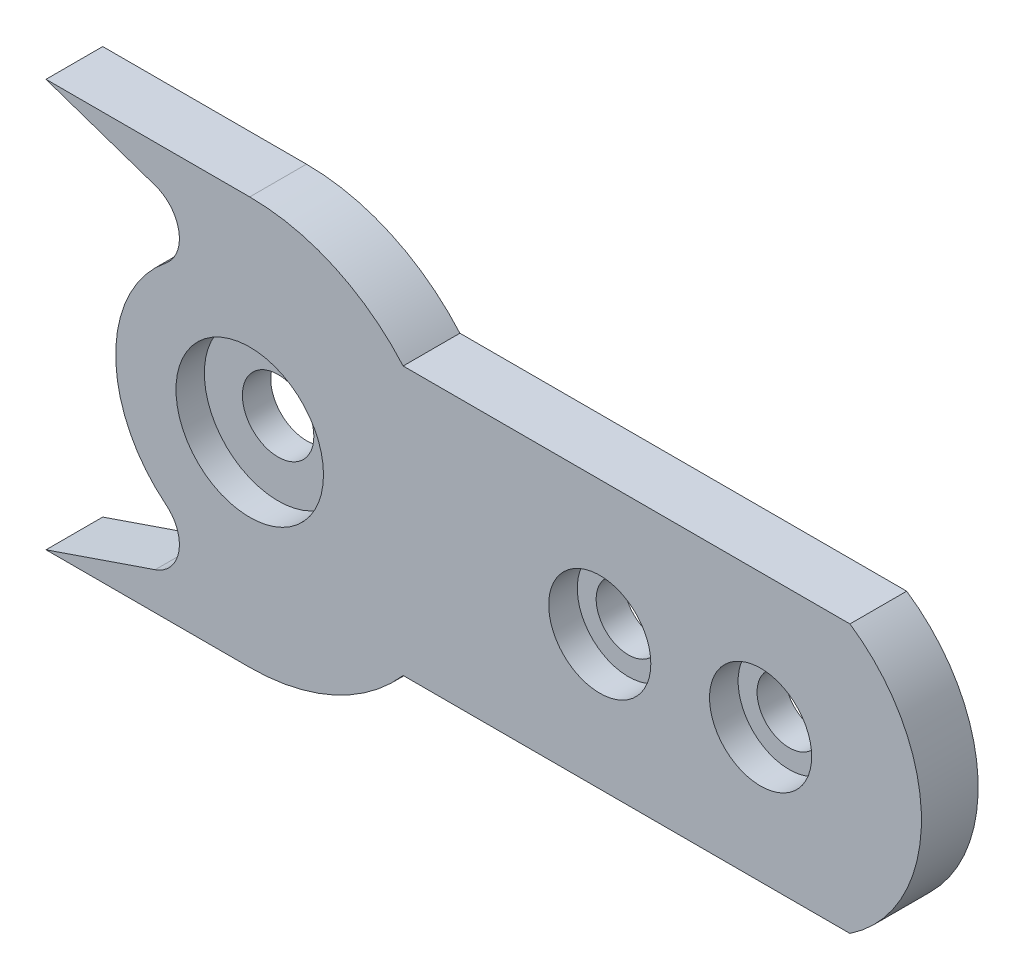
from build123d import *

# Parameters (mm, degrees)
SKETCH1_R           = 10
BOSS_EXTRUDE1_DEPTH = 7.9375
FILLET1_R           = 10
SKETCH2_R           = 14.2875
CUT_EXTRUDE1_DEPTH  = 8
SKETCH3_R           = 9
CUT_EXTRUDE2_DEPTH  = 198.022009439
SKETCH4_R           = 20.6375
CUT_EXTRUDE3_DEPTH  = 7.9375


with BuildPart() as part:
    # Sketch1 → Boss-Extrude1 (new, symmetric)
    with BuildSketch(Plane.XY):
        with BuildLine():
            Line((-57, -57), (0, -37.5))
            ThreePointArc((0, -37.5), (-37.5, 0), (0, 37.5))
            Line((0, 37.5), (-57, 57))
            Line((-57, 57), (0, 57))
            ThreePointArc((0, 57), (23.574350468, 51.896531676), (42.927264064, 37.5))
            Line((42.927264064, 37.5), (167.927264064, 37.5))
            ThreePointArc((167.927264064, 37.5), (187.927264064, 0), (167.927264064, -37.5))
            Line((167.927264064, -37.5), (42.927264064, -37.5))
            ThreePointArc((42.927264064, -37.5), (23.574350468, -51.896531676), (0, -57))
            Line((0, -57), (-57, -57))
        make_face()
        Circle(SKETCH1_R, mode=Mode.SUBTRACT)
    extrude(amount=BOSS_EXTRUDE1_DEPTH, both=True)

    # Fillet1
    fillet1_edges = [part.edges().sort_by_distance(p)[0] for p in [
        (0, -37.5, 0),
        (0, 37.5, 0),
    ]]
    fillet(fillet1_edges, radius=FILLET1_R)

    # Sketch2 → Cut-Extrude1 (cut)
    with BuildSketch(Plane.XY.offset(7.9375)):
        with Locations((142.927264064, 0)):
            Circle(SKETCH2_R)
        with Locations((97.927264064, 0)):
            Circle(SKETCH2_R)
    extrude(amount=-CUT_EXTRUDE1_DEPTH, mode=Mode.SUBTRACT)

    # Sketch3 → Cut-Extrude2 (cut, through all)
    with BuildSketch(Plane.XY.offset(7.9375)):
        with Locations((97.927264064, 0)):
            Circle(SKETCH3_R)
        with Locations((142.927264064, 0)):
            Circle(SKETCH3_R)
    extrude(amount=-CUT_EXTRUDE2_DEPTH, mode=Mode.SUBTRACT)

    # Sketch4 → Cut-Extrude3 (cut)
    with BuildSketch(Plane.XY.offset(7.9375)):
        Circle(SKETCH4_R)
    extrude(amount=-CUT_EXTRUDE3_DEPTH, mode=Mode.SUBTRACT)


solid = part.part
